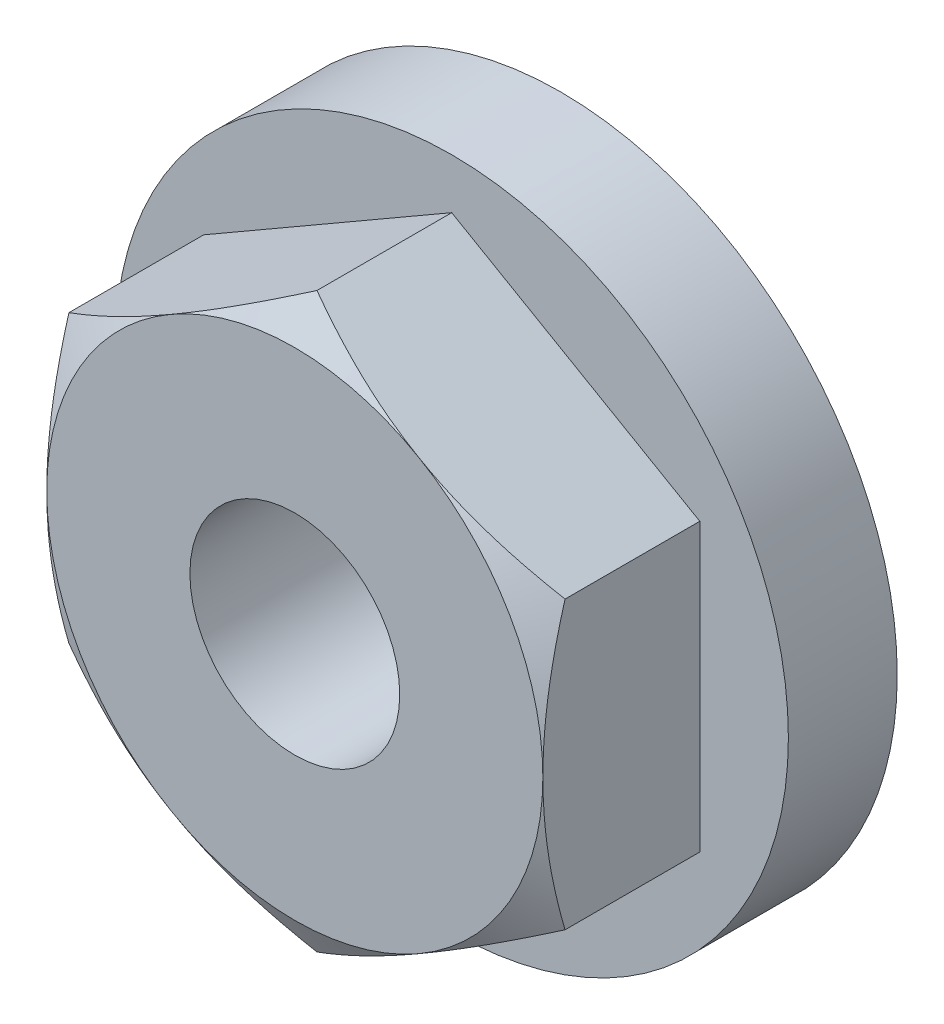
from build123d import *

# Parameters (mm, degrees)
EXTRUDE1_DEPTH     = 5.953125
SKETCH13_R         = 7.540625
EXTRUDE3_DEPTH     = 2.4384
SKETCH2_OUTSIDE_W  = 67.282
SKETCH2_OUTSIDE_H  = 67.282
SKETCH2_OUTSIDE_R  = 5.55625
CUT_EXTRUDE1_DEPTH = 13.213179277
CUT_EXTRUDE1_DRAFT = -60
SKETCH4_R          = 3.175
CUT_EXTRUDE3_DEPTH = 13.213179277
SKETCH12_R         = 3.175
SKETCH12_R_2       = 2.350110803
EXTRUDE2_DEPTH     = 5.953125


with BuildPart() as part:
    # Sketch1 → Extrude1 (new body)
    with BuildSketch(Plane.XY):
        Polygon((0, 6.415804866), (-5.55625, 3.207902433), (-5.55625, -3.207902433), (0, -6.415804866), (5.55625, -3.207902433), (5.55625, 3.207902433), align=None)
    extrude(amount=-EXTRUDE1_DEPTH)

    # Sketch13 → Extrude3 (add)
    with BuildSketch(Plane(origin=(0, 0, -5.953125), x_dir=(-1, 0, 0), z_dir=(0, 0, -1))):
        Circle(SKETCH13_R)
    extrude(amount=-EXTRUDE3_DEPTH)


with BuildPart() as cut_extrude1_tool:
    # Sketch2 outside → Cut-Extrude1 (with draft: the straight prism first)
    with BuildSketch(Plane.XY):
        Rectangle(SKETCH2_OUTSIDE_W, SKETCH2_OUTSIDE_H)
        Circle(SKETCH2_OUTSIDE_R, mode=Mode.SUBTRACT)
    extrude(amount=-CUT_EXTRUDE1_DEPTH)
    # Cut-Extrude1: the draft: its side faces are tilted about the plane it starts from
    cut_extrude1_sides = [cut_extrude1_tool.faces().sort_by_distance(p)[0] for p in [
        (0, -33.641, -6.606589638),
        (33.641, 0, -6.606589638),
        (0, 33.641, -6.606589638),
        (-33.641, 0, -6.606589638),
        (-5.55625, 0, -6.606589638),
    ]]
    draft(cut_extrude1_sides, Plane.XY, CUT_EXTRUDE1_DRAFT)


with BuildPart() as part_1:
    add(part.part)

    # Cut-Extrude1: cut by cut_extrude1_tool
    add(cut_extrude1_tool.part, mode=Mode.SUBTRACT)

    # Sketch4 → Cut-Extrude3 (cut, through all)
    with BuildSketch(Plane.XY):
        Circle(SKETCH4_R)
    extrude(amount=-CUT_EXTRUDE3_DEPTH, mode=Mode.SUBTRACT)

    # Sketch12 → Extrude2 (add)
    with BuildSketch(Plane.XY):
        Circle(SKETCH12_R)
        Circle(SKETCH12_R_2, mode=Mode.SUBTRACT)
    extrude(amount=-EXTRUDE2_DEPTH)


solid = part_1.part
